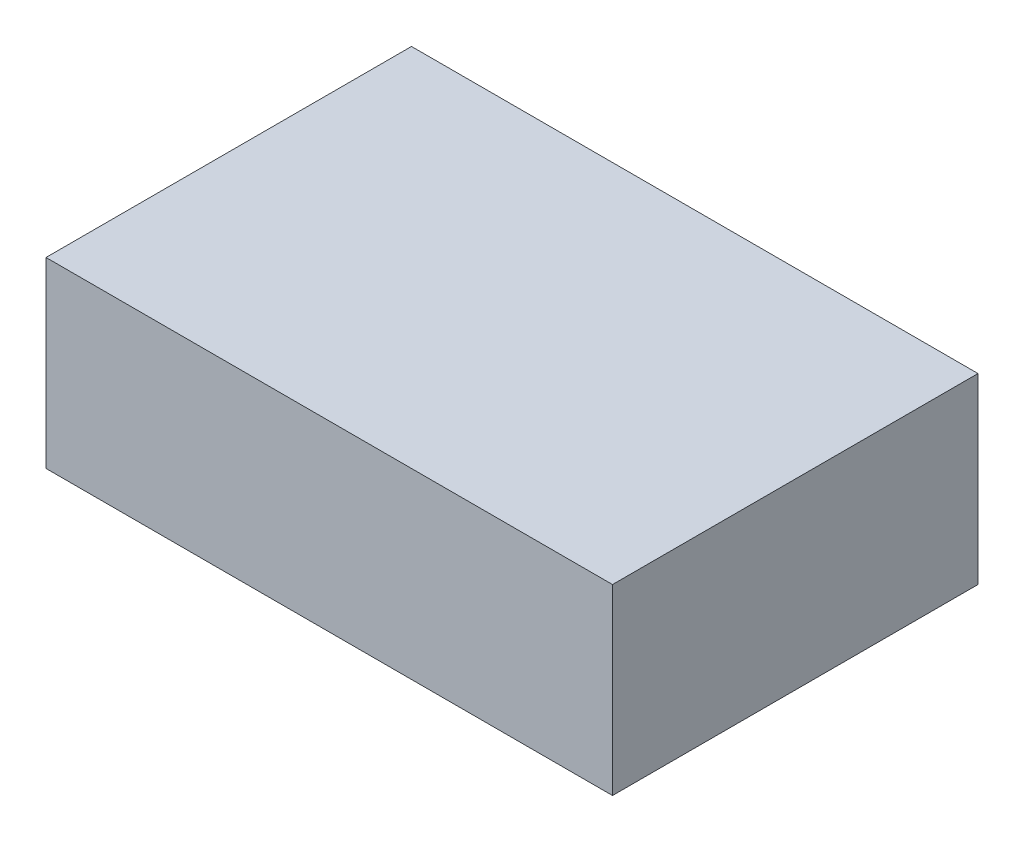
from build123d import *

# Parameters (mm, degrees)
SKETCH1_W           = 31
SKETCH1_H           = 20
BOSS_EXTRUDE1_DEPTH = 10


with BuildPart() as part:
    # Sketch1 → Boss-Extrude1 (new body)
    with BuildSketch(Plane(origin=(0, 0, 0), x_dir=(1, 0, 0), z_dir=(0, 1, 0))):
        with Locations((15.5, 10)):
            Rectangle(SKETCH1_W, SKETCH1_H)
    extrude(amount=-BOSS_EXTRUDE1_DEPTH)


solid = part.part
